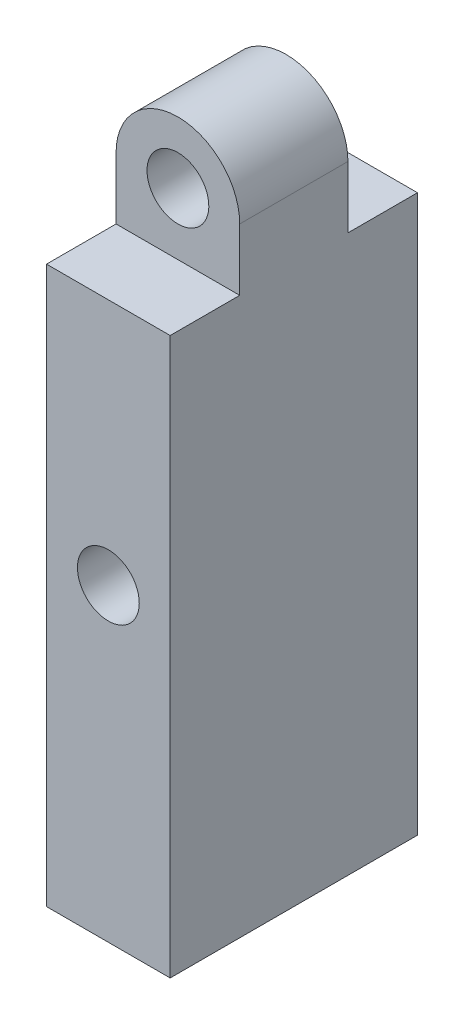
from build123d import *

# Parameters (mm, degrees)
SKETCH_1_R               = 0.5
EXTRUDE_1_DEPTH          = 4
CUT_EXTRUDE_2_DEPTH      = 8.679442038
CUT_EXTRUDE_2_DEPTH_BACK = 8.679442038
SKETCH_2_W               = 1.125
SKETCH_2_H               = 2


with BuildPart() as part:
    # 草图1 → 凸台-拉伸1 (new body)
    with BuildSketch(Plane.XY):
        with BuildLine():
            Line((-1.244261308, -4.563724383), (-1.244261308, 5.436275617))
            ThreePointArc((-1.244261308, 5.436275617), (-0.244261308, 6.436275617), (0.755738692, 5.436275617))
            Line((0.755738692, 5.436275617), (0.755738692, -4.563724383))
            Line((0.755738692, -4.563724383), (-1.244261308, -4.563724383))
        make_face()
        with Locations((-0.244261308, 5.436275617)):
            Circle(SKETCH_1_R, mode=Mode.SUBTRACT)
        with Locations((-0.244261308, 0.436275617)):
            Circle(SKETCH_1_R, mode=Mode.SUBTRACT)
    extrude(amount=EXTRUDE_1_DEPTH)

    # 草图2 → 切除-拉伸2 (cut, two sides: drawn at the far end of the back side and taken through both)
    with BuildSketch(Plane(origin=(0, 0, 0), x_dir=(0, 0, -1), z_dir=(1, 0, 0)).offset(-CUT_EXTRUDE_2_DEPTH_BACK)):
        with Locations((-3.4375, 5.436275617)):
            Rectangle(SKETCH_2_W, SKETCH_2_H)
        with Locations((-0.5625, 5.436275617)):
            Rectangle(SKETCH_2_W, SKETCH_2_H)
    extrude(amount=CUT_EXTRUDE_2_DEPTH + CUT_EXTRUDE_2_DEPTH_BACK, mode=Mode.SUBTRACT)


solid = part.part
